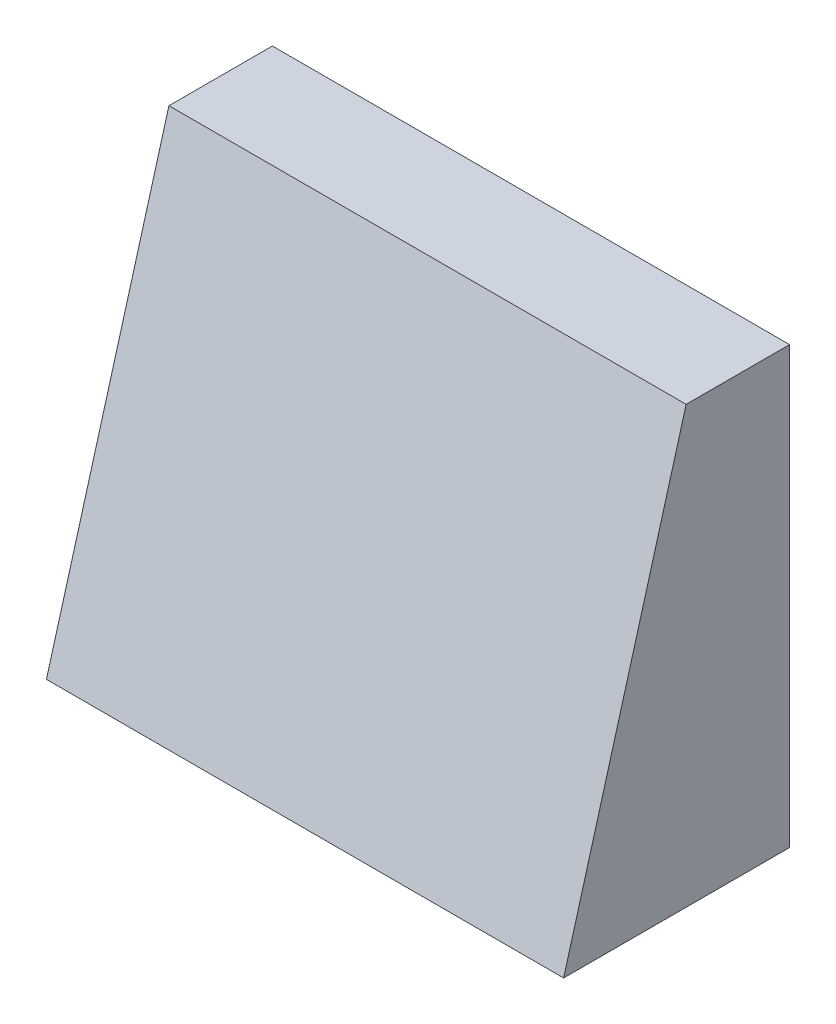
from build123d import *

# Parameters (mm, degrees)
SLOPED_COVER_BLANK_DEPTH                      = 95
SLOPED_COVER_BLANK_DEPTH_BACK                 = 95
OPEN_BOTTOM_AND_FRONT_COVER_CAVITY_DEPTH      = 88
OPEN_BOTTOM_AND_FRONT_COVER_CAVITY_DEPTH_BACK = 88
FRONT_GASKET_COMPRESSION_RAIL_DEPTH           = 95
FRONT_GASKET_COMPRESSION_RAIL_DEPTH_BACK      = 95
FRONT_GASKET_COMPRESSION_RAIL_PROFILE_W       = 3
FRONT_GASKET_COMPRESSION_RAIL_PROFILE_H       = 7


with BuildPart() as part:
    # Sloped Cover Outer Side Profile → Sloped Cover Blank (new, two sides: drawn at the far end of the back side and taken through both)
    with BuildSketch(Plane(origin=(0, 0, 0), x_dir=(0, 0, -1), z_dir=(1, 0, 0)).offset(-SLOPED_COVER_BLANK_DEPTH_BACK)):
        Polygon((-22, 40), (-22, 200), (-60, 200), (-105, 40), align=None)
    extrude(amount=SLOPED_COVER_BLANK_DEPTH + SLOPED_COVER_BLANK_DEPTH_BACK)

    # Open Bottom Cover Cavity Profile → Open Bottom and Front Cover Cavity (cut, two sides: drawn at the far end of the back side and taken through both)
    with BuildSketch(Plane(origin=(0, 0, 0), x_dir=(0, 0, -1), z_dir=(1, 0, 0)).offset(-OPEN_BOTTOM_AND_FRONT_COVER_CAVITY_DEPTH_BACK)):
        Polygon((-18, 38), (-18, 193), (-56, 193), (-101, 38), align=None)
    extrude(amount=OPEN_BOTTOM_AND_FRONT_COVER_CAVITY_DEPTH + OPEN_BOTTOM_AND_FRONT_COVER_CAVITY_DEPTH_BACK, mode=Mode.SUBTRACT)

    # Front Gasket Compression Rail Profile → Front Gasket Compression Rail (add, two sides: drawn at the far end of the back side and taken through both)
    with BuildSketch(Plane(origin=(0, 0, 0), x_dir=(0, 0, -1), z_dir=(1, 0, 0)).offset(-FRONT_GASKET_COMPRESSION_RAIL_DEPTH_BACK)):
        with Locations((-23.5, 48.5)):
            Rectangle(FRONT_GASKET_COMPRESSION_RAIL_PROFILE_W, FRONT_GASKET_COMPRESSION_RAIL_PROFILE_H)
    extrude(amount=FRONT_GASKET_COMPRESSION_RAIL_DEPTH + FRONT_GASKET_COMPRESSION_RAIL_DEPTH_BACK)


solid = part.part
